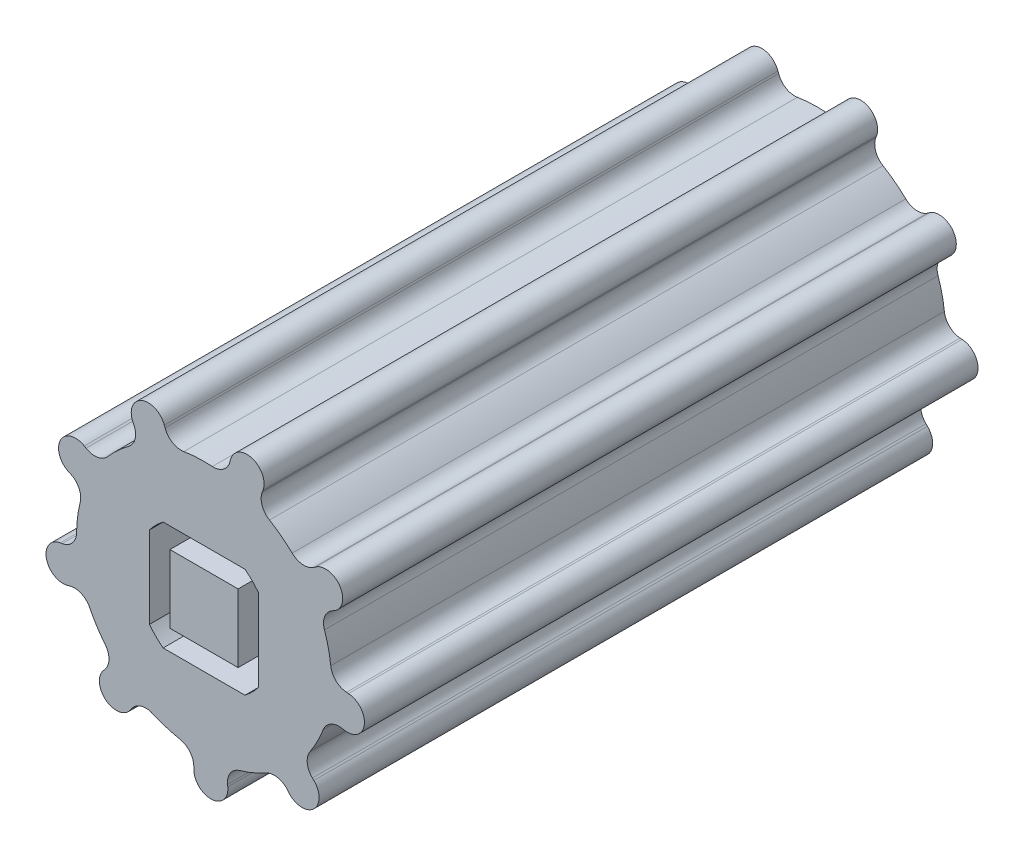
from build123d import *

# Parameters (mm, degrees)
BOSS_EXTRUDE1_DEPTH = 22.5
SKETCH2_W           = 5
SKETCH2_H           = 5
CUT_EXTRUDE1_DEPTH  = 10


with BuildPart() as part:
    # Sketch1 → Boss-Extrude1 (new, symmetric)
    with BuildSketch(Plane.XY):
        with BuildLine():
            Line((1.939814393, 10.4209942), (1.904028006, 10.276656915))
            ThreePointArc((1.904028006, 10.276656915), (1.428480454, 9.568373768), (0.609305018, 9.330125797))
            ThreePointArc((0.609305018, 9.330125797), (-0.439609364, 9.339659716), (-1.482990759, 9.231643321))
            ThreePointArc((-1.482990759, 9.231643321), (-2.320923107, 9.391892722), (-2.860897269, 10.052376178))
            Line((-2.860897269, 10.052376178), (-2.910083052, 10.192713899))
            ThreePointArc((-2.910083052, 10.192713899), (-4.572008101, 10.932485624), (-5.212501917, 9.229833356))
            Line((-5.212501917, 9.229833356), (-5.14713766, 9.096261535))
            ThreePointArc((-5.14713766, 9.096261535), (-5.056152588, 8.248009091), (-5.530534536, 7.538944737))
            ThreePointArc((-5.530534536, 7.538944737), (-6.340177854, 6.872018974), (-7.070022774, 6.118600982))
            ThreePointArc((-7.070022774, 6.118600982), (-7.814922522, 5.702746613), (-8.65311731, 5.861617594))
            Line((-8.65311731, 5.861617594), (-8.781003154, 5.937506514))
            ThreePointArc((-8.781003154, 5.937506514), (-10.529627702, 5.435939703), (-9.925830648, 3.719930906))
            Line((-9.925830648, 3.719930906), (-9.789900412, 3.659624288))
            ThreePointArc((-9.789900412, 3.659624288), (-9.174955642, 3.068309294), (-9.082575516, 2.220207648))
            ThreePointArc((-9.082575516, 2.220207648), (-9.274106664, 1.18888418), (-9.348912558, 0.142597243))
            ThreePointArc((-9.348912558, 0.142597243), (-9.652232836, -0.654778014), (-10.396447593, -1.071857007))
            Line((-10.396447593, -1.071857007), (-10.543194291, -1.095926157))
            ThreePointArc((-10.543194291, -1.095926157), (-11.560317477, -2.604142819), (-9.994752906, -3.530568558))
            Line((-9.994752906, -3.530568558), (-9.851859958, -3.489391835))
            ThreePointArc((-9.851859958, -3.489391835), (-9.000694983, -3.547086522), (-8.38477847, -4.137389275))
            ThreePointArc((-8.38477847, -4.137389275), (-7.868577895, -5.050542735), (-7.253342256, -5.900129331))
            ThreePointArc((-7.253342256, -5.900129331), (-6.973156133, -6.705924732), (-7.275164503, -7.503797802))
            Line((-7.275164503, -7.503797802), (-7.372107645, -7.616562799))
            ThreePointArc((-7.372107645, -7.616562799), (-7.181806226, -9.425717974), (-5.3870192, -9.129075755))
            Line((-5.3870192, -9.129075755), (-5.304024738, -9.005682738))
            ThreePointArc((-5.304024738, -9.005682738), (-4.614909109, -8.502761133), (-3.763650392, -8.559055773))
            ThreePointArc((-3.763650392, -8.559055773), (-2.781254079, -8.926764573), (-1.763852499, -9.182119818))
            ThreePointArc((-1.763852499, -9.182119818), (-1.031262177, -9.61929474), (-0.749751088, -10.424628209))
            Line((-0.749751088, -10.424628209), (-0.751529899, -10.573325059))
            ThreePointArc((-0.751529899, -10.573325059), (0.557151975, -11.836894934), (1.74136066, -10.455986948))
            Line((1.74136066, -10.455986948), (1.725622604, -10.308114601))
            ThreePointArc((1.725622604, -10.308114601), (1.930244025, -9.479899312), (2.618531533, -8.975844952))
            ThreePointArc((2.618531533, -8.975844952), (3.60744943, -8.626054058), (4.550963444, -8.167694395))
            ThreePointArc((4.550963444, -8.167694395), (5.393170812, -8.031689832), (6.126479194, -8.467659221))
            Line((6.126479194, -8.467659221), (6.220697038, -8.582711015))
            ThreePointArc((6.220697038, -8.582711015), (8.035412575, -8.709457202), (8.054938514, -6.890425643))
            Line((8.054938514, -6.890425643), (7.947831951, -6.78726508))
            ThreePointArc((7.947831951, -6.78726508), (7.572214528, -6.021287246), (7.775473452, -5.192736523))
            ThreePointArc((7.775473452, -5.192736523), (8.308187259, -4.289116981), (8.736333014, -3.33151399))
            ThreePointArc((8.736333014, -3.33151399), (9.29407924, -2.68596799), (10.136061773, -2.548578376))
            Line((10.136061773, -2.548578376), (10.282190696, -2.5761511))
            ThreePointArc((10.282190696, -2.5761511), (11.753814328, -1.50676765), (10.599521117, -0.100757601))
            Line((10.599521117, -0.100757601), (10.451162399, -0.090578797))
            ThreePointArc((10.451162399, -0.090578797), (9.671061698, 0.254752041), (9.294184928, 1.020111037))
            ThreePointArc((9.294184928, 1.020111037), (9.121431934, 2.0547456), (8.833875273, 3.063518836))
            ThreePointArc((8.833875273, 3.063518836), (8.8461847, 3.916548126), (9.402868399, 4.563010616))
            Line((9.402868399, 4.563010616), (9.532533054, 4.635818545))
            ThreePointArc((9.532533054, 4.635818545), (9.972475727, 6.400955231), (8.184469989, 6.736056042))
            Line((8.184469989, 6.736056042), (8.064277808, 6.648490313))
            ThreePointArc((8.064277808, 6.648490313), (7.244711617, 6.411590018), (6.464043982, 6.755637305))
            ThreePointArc((6.464043982, 6.755637305), (5.666657234, 7.437169878), (4.797949114, 8.025097152))
            ThreePointArc((4.797949114, 8.025097152), (4.259062024, 8.686467846), (4.269968399, 9.539516228))
            Line((4.269968399, 9.539516228), (4.322497253, 9.678637172))
            ThreePointArc((4.322497253, 9.678637172), (3.524904902, 11.313600021), (1.939814393, 10.4209942))
        make_face()
    extrude(amount=BOSS_EXTRUDE1_DEPTH, both=True)

    # Sketch2 → Cut-Extrude1 (cut)
    with BuildSketch(Plane.XY.offset(22.5)):
        with BuildLine():
            Line((-3, -4), (3, -4))
            ThreePointArc((3, -4), (3.535533906, -3.535533906), (4, -3))
            Line((4, -3), (4, 3))
            ThreePointArc((4, 3), (3.535533906, 3.535533906), (3, 4))
            Line((3, 4), (-3, 4))
            ThreePointArc((-3, 4), (-3.535533906, 3.535533906), (-4, 3))
            Line((-4, 3), (-4, -3))
            ThreePointArc((-4, -3), (-3.535533906, -3.535533906), (-3, -4))
        make_face()
        Rectangle(SKETCH2_W, SKETCH2_H, mode=Mode.SUBTRACT)
    cut_extrude1 = extrude(amount=-CUT_EXTRUDE1_DEPTH, mode=Mode.SUBTRACT)

    # Mirror1: Cut-Extrude1 across plane
    add(cut_extrude1.mirror(Plane.XY), mode=Mode.SUBTRACT)


solid = part.part
